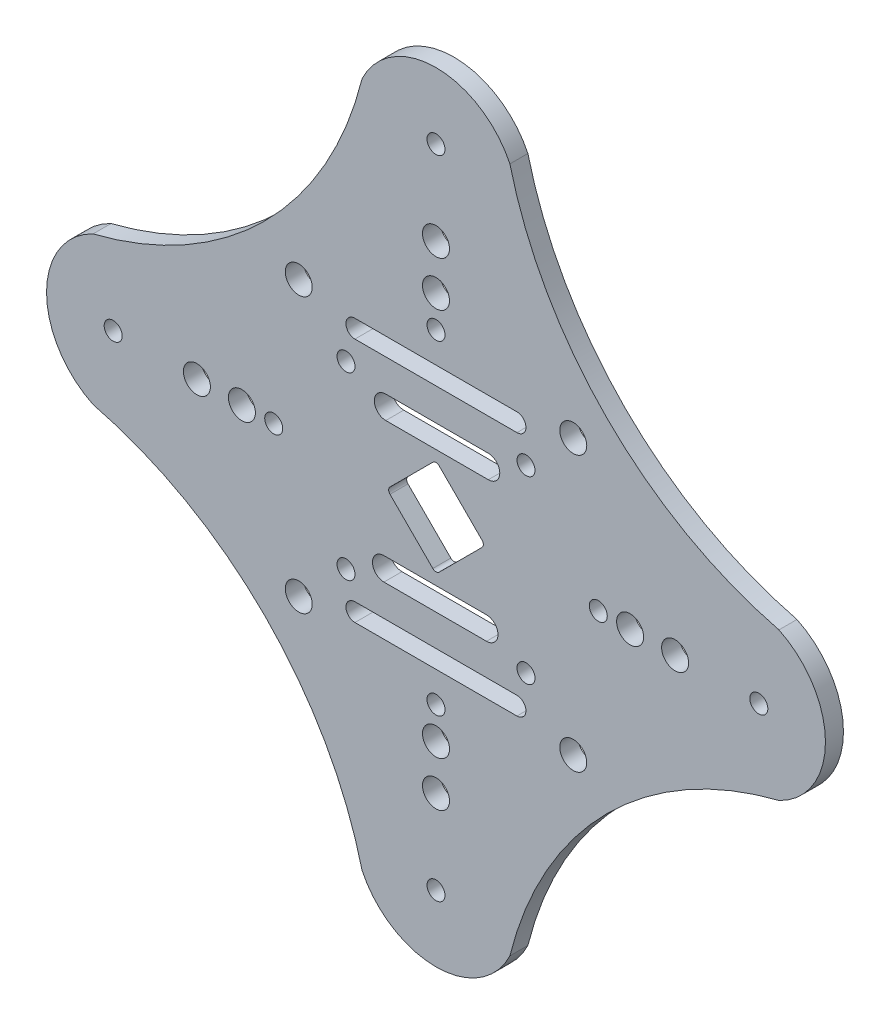
from build123d import *

# Parameters (mm, degrees)
MODEL_R         = 1
MODEL_R_2       = 1.5
EXTRUDE_1_DEPTH = 2


with BuildPart() as part:
    # Model → 凸台-拉伸1 (new body)
    with BuildSketch(Plane.XY):
        with BuildLine():
            ThreePointArc((165.794247794, 119.146851779), (174.607099306, 112.447515783), (184.890996066, 108.350087077))
            ThreePointArc((184.890996066, 108.350087077), (190.059733129, 100.139821501), (184.890996066, 91.929555925))
            ThreePointArc((184.890996066, 91.929555925), (174.607099306, 87.832127219), (165.794247794, 81.132791223))
            ThreePointArc((165.794247794, 81.132791223), (159.094911797, 72.319939711), (154.997483091, 62.036042951))
            ThreePointArc((154.997483091, 62.036042951), (146.787217515, 56.867305888), (138.576951939, 62.036042951))
            ThreePointArc((138.576951939, 62.036042951), (134.479523234, 72.319939711), (127.780187237, 81.132791223))
            ThreePointArc((127.780187237, 81.132791223), (118.967335725, 87.832127219), (108.683438965, 91.929555925))
            ThreePointArc((108.683438965, 91.929555925), (103.514701902, 100.139821501), (108.683438965, 108.350087077))
            ThreePointArc((108.683438965, 108.350087077), (118.967335725, 112.447515783), (127.780187237, 119.146851779))
            ThreePointArc((127.780187237, 119.146851779), (134.479523234, 127.959703291), (138.576951939, 138.243600051))
            ThreePointArc((138.576951939, 138.243600051), (146.787217515, 143.412337115), (154.997483091, 138.243600051))
            ThreePointArc((154.997483091, 138.243600051), (159.094911797, 127.959703291), (165.794247794, 119.146851779))
        make_face()
        with Locations((156.787217515, 110.139821501)):
            Circle(MODEL_R, mode=Mode.SUBTRACT)
        with Locations((136.787217515, 110.139821501)):
            Circle(MODEL_R, mode=Mode.SUBTRACT)
        with Locations((136.787217515, 90.139821501)):
            Circle(MODEL_R, mode=Mode.SUBTRACT)
        with Locations((156.787217515, 90.139821501)):
            Circle(MODEL_R, mode=Mode.SUBTRACT)
        with Locations((168.353974342, 100.139821501)):
            Circle(MODEL_R_2, mode=Mode.SUBTRACT)
        with Locations((146.787217515, 121.706578327)):
            Circle(MODEL_R_2, mode=Mode.SUBTRACT)
        with Locations((125.220460689, 100.139821501)):
            Circle(MODEL_R_2, mode=Mode.SUBTRACT)
        with Locations((146.787217515, 78.573064675)):
            Circle(MODEL_R_2, mode=Mode.SUBTRACT)
        with Locations((146.787217515, 126.706578327)):
            Circle(MODEL_R_2, mode=Mode.SUBTRACT)
        with Locations((120.220460689, 100.139821501)):
            Circle(MODEL_R_2, mode=Mode.SUBTRACT)
        with Locations((146.787217515, 73.573064675)):
            Circle(MODEL_R_2, mode=Mode.SUBTRACT)
        with Locations((173.353974342, 100.139821501)):
            Circle(MODEL_R_2, mode=Mode.SUBTRACT)
        with Locations((146.787217515, 118.171044401)):
            Circle(MODEL_R, mode=Mode.SUBTRACT)
        with Locations((128.755994615, 100.139821501)):
            Circle(MODEL_R, mode=Mode.SUBTRACT)
        with Locations((146.787217515, 82.108598601)):
            Circle(MODEL_R, mode=Mode.SUBTRACT)
        with Locations((164.818440415, 100.139821501)):
            Circle(MODEL_R, mode=Mode.SUBTRACT)
        with Locations((162.037217515, 115.389821501)):
            Circle(MODEL_R_2, mode=Mode.SUBTRACT)
        with Locations((131.537217515, 115.389821501)):
            Circle(MODEL_R_2, mode=Mode.SUBTRACT)
        with Locations((131.537217515, 84.889821501)):
            Circle(MODEL_R_2, mode=Mode.SUBTRACT)
        with Locations((162.037217515, 84.889821501)):
            Circle(MODEL_R_2, mode=Mode.SUBTRACT)
        with Locations((182.657217515, 100.139821501)):
            Circle(MODEL_R, mode=Mode.SUBTRACT)
        with Locations((146.787217515, 136.036864466)):
            Circle(MODEL_R, mode=Mode.SUBTRACT)
        with Locations((110.917217515, 100.139821501)):
            Circle(MODEL_R, mode=Mode.SUBTRACT)
        with Locations((146.787217515, 64.242778536)):
            Circle(MODEL_R, mode=Mode.SUBTRACT)
        with BuildLine():
            Line((152.398515146, 91.006916148), (141.004728844, 91.006916149))
            ThreePointArc((141.004728844, 91.006916149), (140.104214379, 91.379921453), (139.731209075, 92.280435918))
            ThreePointArc((139.731209075, 92.280435918), (140.104214379, 93.180950383), (141.004728844, 93.553955688))
            Line((141.004728844, 93.553955688), (152.398515146, 93.553955687))
            ThreePointArc((152.398515146, 93.553955687), (153.672034916, 92.280435917), (152.398515146, 91.006916148))
        make_face(mode=Mode.SUBTRACT)
        with BuildLine():
            Line((152.599718137, 109.199272945), (141.205931835, 109.199272945))
            ThreePointArc((141.205931835, 109.199272945), (140.30541737, 108.826267641), (139.932412066, 107.925753176))
            ThreePointArc((139.932412066, 107.925753176), (140.30541737, 107.025238711), (141.205931835, 106.652233406))
            Line((141.205931835, 106.652233406), (152.599718137, 106.652233406))
            ThreePointArc((152.599718137, 106.652233406), (153.873237907, 107.925753176), (152.599718137, 109.199272945))
        make_face(mode=Mode.SUBTRACT)
        with BuildLine():
            Line((151.898560909, 100.493374892), (147.140770906, 105.251164895))
            ThreePointArc((147.140770906, 105.251164895), (146.787217515, 105.397611504), (146.433664125, 105.251164895))
            Line((146.433664125, 105.251164895), (141.675874122, 100.493374892))
            ThreePointArc((141.675874122, 100.493374892), (141.529427512, 100.139821501), (141.675874122, 99.786268111))
            Line((141.675874122, 99.786268111), (146.433664125, 95.028478108))
            ThreePointArc((146.433664125, 95.028478108), (146.787217515, 94.882031498), (147.140770906, 95.028478108))
            Line((147.140770906, 95.028478108), (151.898560909, 99.786268111))
            ThreePointArc((151.898560909, 99.786268111), (152.045007518, 100.139821501), (151.898560909, 100.493374892))
        make_face(mode=Mode.SUBTRACT)
        with BuildLine():
            Line((137.779884988, 87.503468035), (155.779884988, 87.503468035))
            ThreePointArc((155.779884988, 87.503468035), (156.779884988, 86.503468035), (155.779884988, 85.503468035))
            Line((155.779884988, 85.503468035), (137.779884988, 85.503468035))
            ThreePointArc((137.779884988, 85.503468035), (137.072778206, 85.796361253), (136.779884988, 86.503468035))
            ThreePointArc((136.779884988, 86.503468035), (137.072778206, 87.210574816), (137.779884988, 87.503468035))
        make_face(mode=Mode.SUBTRACT)
        with BuildLine():
            Line((137.779884988, 112.776174968), (155.779884988, 112.776174968))
            ThreePointArc((155.779884988, 112.776174968), (156.779884988, 113.776174968), (155.779884988, 114.776174968))
            Line((155.779884988, 114.776174968), (137.779884988, 114.776174968))
            ThreePointArc((137.779884988, 114.776174968), (137.072778206, 114.483281749), (136.779884988, 113.776174968))
            ThreePointArc((136.779884988, 113.776174968), (137.072778206, 113.069068187), (137.779884988, 112.776174968))
        make_face(mode=Mode.SUBTRACT)
    extrude(amount=EXTRUDE_1_DEPTH)


solid = part.part
